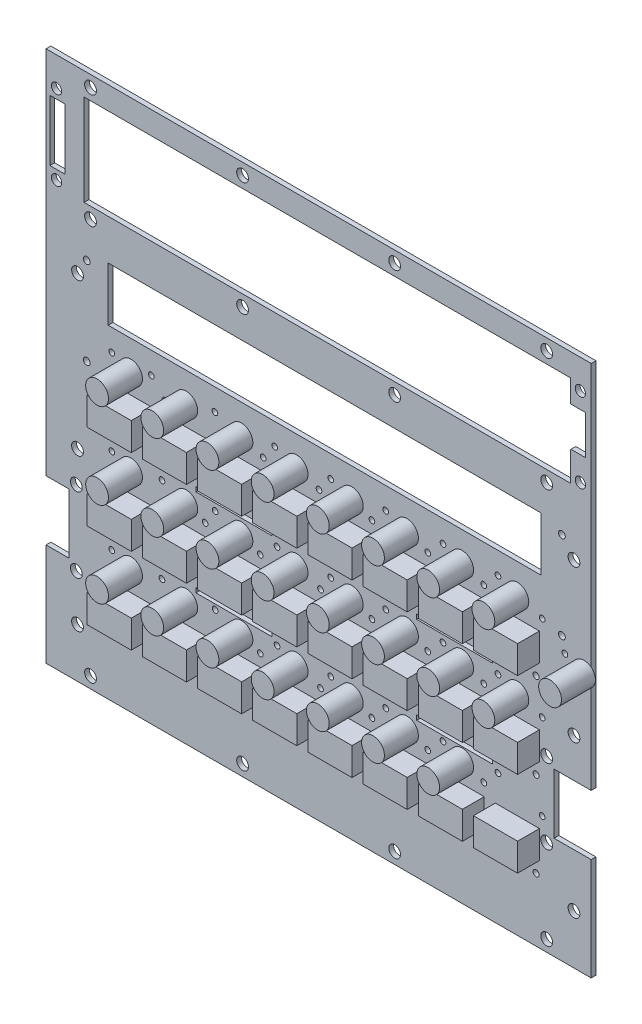
from build123d import *

# Parameters (mm, degrees)
SKETCH1_W                       = 144.56156
SKETCH1_H                       = 18.00098
SKETCH1_W_2                     = 5.08
SKETCH1_H_2                     = 20.32
SKETCH1_W_3                     = 25.4
SKETCH1_H_3                     = 1.5875
BOARD_DEPTH                     = 1.592072
SKETCH2_R                       = 3.81
LED_KINGBRIGHT_3P_2P54_1_DEPTH  = 11.3538
SKETCH4_R                       = 3.81
LED_KINGBRIGHT_3P_2P54_3_DEPTH  = 11.3538
SKETCH5_R                       = 3.81
LED_KINGBRIGHT_3P_2P54_4_DEPTH  = 11.3538
SKETCH6_R                       = 3.81
LED_KINGBRIGHT_3P_2P54_5_DEPTH  = 11.3538
SKETCH7_R                       = 3.81
LED_KINGBRIGHT_3P_2P54_6_DEPTH  = 11.3538
SKETCH8_R                       = 3.81
LED_KINGBRIGHT_3P_2P54_7_DEPTH  = 11.3538
SKETCH9_R                       = 3.81
LED_KINGBRIGHT_3P_2P54_8_DEPTH  = 11.3538
SKETCH10_R                      = 3.81
LED_KINGBRIGHT_3P_2P54_9_DEPTH  = 11.3538
SKETCH11_R                      = 3.81
LED_KINGBRIGHT_3P_2P54_10_DEPTH = 11.3538
SKETCH12_R                      = 3.81
LED_KINGBRIGHT_3P_2P54_11_DEPTH = 11.3538
SKETCH13_R                      = 3.81
LED_KINGBRIGHT_3P_2P54_12_DEPTH = 11.3538
SKETCH14_R                      = 3.81
LED_KINGBRIGHT_3P_2P54_13_DEPTH = 11.3538
SKETCH15_R                      = 3.81
LED_KINGBRIGHT_3P_2P54_14_DEPTH = 11.3538
SKETCH16_R                      = 3.81
LED_KINGBRIGHT_3P_2P54_15_DEPTH = 11.3538
SKETCH17_R                      = 3.81
LED_KINGBRIGHT_3P_2P54_16_DEPTH = 11.3538
SKETCH18_R                      = 3.81
LED_KINGBRIGHT_3P_2P54_17_DEPTH = 11.3538
SKETCH19_R                      = 3.81
LED_KINGBRIGHT_3P_2P54_18_DEPTH = 11.3538
SKETCH20_R                      = 3.81
LED_KINGBRIGHT_3P_2P54_19_DEPTH = 11.3538
SKETCH21_R                      = 3.81
LED_KINGBRIGHT_3P_2P54_20_DEPTH = 11.3538
SKETCH22_R                      = 3.81
LED_KINGBRIGHT_3P_2P54_21_DEPTH = 11.3538
SKETCH23_R                      = 3.81
LED_KINGBRIGHT_3P_2P54_22_DEPTH = 11.3538
SKETCH24_R                      = 3.81
LED_KINGBRIGHT_3P_2P54_23_DEPTH = 11.3538
SKETCH25_R                      = 3.81
LED_KINGBRIGHT_3P_2P54_24_DEPTH = 11.3538
SKETCH26_R                      = 3.81
LED_KINGBRIGHT_3P_2P54_25_DEPTH = 11.3538
SKETCH27_W                      = 14.732
SKETCH27_H                      = 9.271
SWITCH_MCDTS2_1_DEPTH           = 7.3000108
SKETCH28_W                      = 14.732
SKETCH28_H                      = 9.271
SWITCH_MCDTS2_2_DEPTH           = 7.3000108
SKETCH29_W                      = 14.732
SKETCH29_H                      = 9.271
SWITCH_MCDTS2_3_DEPTH           = 7.3000108
SKETCH30_W                      = 14.732
SKETCH30_H                      = 9.271
SWITCH_MCDTS2_4_DEPTH           = 7.3000108
SKETCH31_W                      = 14.732
SKETCH31_H                      = 9.271
SWITCH_MCDTS2_5_DEPTH           = 7.3000108
SKETCH32_W                      = 14.732
SKETCH32_H                      = 9.271
SWITCH_MCDTS2_6_DEPTH           = 7.3000108
SKETCH33_W                      = 14.732
SKETCH33_H                      = 9.271
SWITCH_MCDTS2_7_DEPTH           = 7.3000108
SKETCH34_W                      = 14.732
SKETCH34_H                      = 9.271
SWITCH_MCDTS2_8_DEPTH           = 7.3000108
SKETCH35_W                      = 14.732
SKETCH35_H                      = 9.271
SWITCH_MCDTS2_9_DEPTH           = 7.3000108
SKETCH36_W                      = 14.732
SKETCH36_H                      = 9.271
SWITCH_MCDTS2_10_DEPTH          = 7.3000108
SKETCH37_W                      = 14.732
SKETCH37_H                      = 9.271
SWITCH_MCDTS2_11_DEPTH          = 7.3000108
SKETCH38_W                      = 14.732
SKETCH38_H                      = 9.271
SWITCH_MCDTS2_12_DEPTH          = 7.3000108
SKETCH39_W                      = 14.732
SKETCH39_H                      = 9.271
SWITCH_MCDTS2_13_DEPTH          = 7.3000108
SKETCH40_W                      = 14.732
SKETCH40_H                      = 9.271
SWITCH_MCDTS2_14_DEPTH          = 7.3000108
SKETCH41_W                      = 14.732
SKETCH41_H                      = 9.271
SWITCH_MCDTS2_15_DEPTH          = 7.3000108
SKETCH42_W                      = 14.732
SKETCH42_H                      = 9.271
SWITCH_MCDTS2_16_DEPTH          = 7.3000108
SKETCH43_W                      = 14.732
SKETCH43_H                      = 9.271
SWITCH_MCDTS2_17_DEPTH          = 7.3000108
SKETCH44_W                      = 14.732
SKETCH44_H                      = 9.271
SWITCH_MCDTS2_18_DEPTH          = 7.3000108
SKETCH45_W                      = 14.732
SKETCH45_H                      = 9.271
SWITCH_MCDTS2_19_DEPTH          = 7.3000108
SKETCH46_W                      = 14.732
SKETCH46_H                      = 9.271
SWITCH_MCDTS2_20_DEPTH          = 7.3000108
SKETCH47_W                      = 14.732
SKETCH47_H                      = 9.271
SWITCH_MCDTS2_21_DEPTH          = 7.3000108
SKETCH48_W                      = 14.732
SKETCH48_H                      = 9.271
SWITCH_MCDTS2_22_DEPTH          = 7.3000108
SKETCH49_W                      = 14.732
SKETCH49_H                      = 9.271
SWITCH_MCDTS2_23_DEPTH          = 7.3000108
SKETCH50_W                      = 14.732
SKETCH50_H                      = 9.271
SWITCH_MCDTS2_24_DEPTH          = 7.3000108
SKETCH59_R                      = 1.016
SKETCH59_R_2                    = 0.9652
SKETCH59_R_3                    = 0.9525
SKETCH59_R_4                    = 1.9685
SKETCH59_R_5                    = 1.1303
SKETCH59_R_6                    = 1.7145
CUT_EXTRUDE1_DEPTH              = 10


with BuildPart() as part:
    # Sketch1 → BOARD (new body)
    with BuildSketch(Plane.XY):
        Polygon((0, 0), (182.118, 0), (182.118, 34.24682), (169.7355, 34.24682), (169.7355, 54.24678), (182.118, 54.24678), (182.118, 177.8), (0, 177.8), (0, 54.24678), (7.62, 54.24678), (7.62, 34.24682), (0, 34.24682), align=None)
        with Locations((93.01988, 117.17909)):
            Rectangle(SKETCH1_W, SKETCH1_H, mode=Mode.SUBTRACT)
        with Locations((3.81, 154.813)):
            Rectangle(SKETCH1_W_2, SKETCH1_H_2, mode=Mode.SUBTRACT)
        Polygon((12.7, 139.7), (12.7, 170.18), (175.26, 170.18), (175.26, 162.6616), (180.086, 162.6616), (180.2892, 162.4584), (180.2892, 149.606), (175.3616, 149.606), (175.26, 149.5044), (175.26, 139.7), align=None, mode=Mode.SUBTRACT)
        with Locations((62.7634, 46.20895)):
            Rectangle(SKETCH1_W_3, SKETCH1_H_3, mode=Mode.SUBTRACT)
        with Locations((136.5134176, 46.20895)):
            Rectangle(SKETCH1_W_3, SKETCH1_H_3, mode=Mode.SUBTRACT)
        with Locations((136.5134176, 75.41895)):
            Rectangle(SKETCH1_W_3, SKETCH1_H_3, mode=Mode.SUBTRACT)
        with Locations((62.7634, 75.41895)):
            Rectangle(SKETCH1_W_3, SKETCH1_H_3, mode=Mode.SUBTRACT)
    extrude(amount=BOARD_DEPTH)

    # Sketch59 → Cut-Extrude1 (cut)
    with BuildSketch(Plane.XY.offset(1.592072)):
        with Locations((163.703, 21.1074)):
            Circle(SKETCH59_R)
        with Locations((163.703, 49.6824)):
            Circle(SKETCH59_R)
        with Locations((145.2626, 21.8186)):
            Circle(SKETCH59_R_2)
        with Locations((126.8476, 21.6154)):
            Circle(SKETCH59_R_2)
        with Locations((108.4072, 21.7424)):
            Circle(SKETCH59_R_2)
        with Locations((89.9668, 21.844)):
            Circle(SKETCH59_R_2)
        with Locations((71.5264, 20.7772)):
            Circle(SKETCH59_R_2)
        with Locations((53.086, 21.1582)):
            Circle(SKETCH59_R_2)
        with Locations((34.6472002, 21.1328)):
            Circle(SKETCH59_R)
        with Locations((145.2626, 49.5554)):
            Circle(SKETCH59_R)
        with Locations((126.8222, 49.3522)):
            Circle(SKETCH59_R)
        with Locations((108.3818, 49.1236)):
            Circle(SKETCH59_R)
        with Locations((89.9414, 49.6824)):
            Circle(SKETCH59_R)
        with Locations((71.501, 49.1998)):
            Circle(SKETCH59_R)
        with Locations((53.0606, 49.1998)):
            Circle(SKETCH59_R)
        with Locations((34.6202, 49.276)):
            Circle(SKETCH59_R)
        with Locations((163.703, 78.2574)):
            Circle(SKETCH59_R)
        with Locations((145.2626, 77.7748)):
            Circle(SKETCH59_R)
        with Locations((126.746, 78.3336)):
            Circle(SKETCH59_R)
        with Locations((108.3818, 78.74)):
            Circle(SKETCH59_R)
        with Locations((89.9414, 78.3336)):
            Circle(SKETCH59_R)
        with Locations((71.501, 78.2574)):
            Circle(SKETCH59_R)
        with Locations((53.0606, 78.4098)):
            Circle(SKETCH59_R)
        with Locations((34.6202, 78.0542)):
            Circle(SKETCH59_R)
        with Locations((91.694, 38.6588)):
            Circle(SKETCH59_R_3)
        with Locations((77.1652, 43.7388)):
            Circle(SKETCH59_R_3)
        with Locations((71.5772, 38.6588)):
            Circle(SKETCH59_R_3)
        with Locations((56.4896, 43.7388)):
            Circle(SKETCH59_R_3)
        with Locations((38.735, 43.7388)):
            Circle(SKETCH59_R_3)
        with Locations((21.8948, 38.6588)):
            Circle(SKETCH59_R_3)
        with Locations((21.971, 43.7388)):
            Circle(SKETCH59_R_3)
        with Locations((77.1652, 72.3138)):
            Circle(SKETCH59_R_3)
        with Locations((91.694, 67.2338)):
            Circle(SKETCH59_R_3)
        with Locations((71.5772, 67.2338)):
            Circle(SKETCH59_R_3)
        with Locations((56.4896, 72.3138)):
            Circle(SKETCH59_R_3)
        with Locations((53.1368, 67.2338)):
            Circle(SKETCH59_R_3)
        with Locations((38.735, 72.3138)):
            Circle(SKETCH59_R_3)
        with Locations((21.8948, 67.2338)):
            Circle(SKETCH59_R_3)
        with Locations((21.971, 72.3138)):
            Circle(SKETCH59_R_3)
        with Locations((165.735, 95.8088)):
            Circle(SKETCH59_R_3)
        with Locations((150.9776, 100.8888)):
            Circle(SKETCH59_R_3)
        with Locations((146.2278, 95.8088)):
            Circle(SKETCH59_R_3)
        with Locations((132.6134, 100.8888)):
            Circle(SKETCH59_R_3)
        with Locations((113.4872, 100.8888)):
            Circle(SKETCH59_R_3)
        with Locations((127.508, 95.8088)):
            Circle(SKETCH59_R_3)
        with Locations((108.8644, 95.8088)):
            Circle(SKETCH59_R_3)
        with Locations((95.0976, 100.8888)):
            Circle(SKETCH59_R_3)
        with Locations((91.186, 95.8088)):
            Circle(SKETCH59_R_3)
        with Locations((76.3778, 100.8888)):
            Circle(SKETCH59_R_3)
        with Locations((72.5424, 95.8088)):
            Circle(SKETCH59_R_3)
        with Locations((56.4134, 100.8888)):
            Circle(SKETCH59_R_3)
        with Locations((39.7256, 95.8088)):
            Circle(SKETCH59_R_3)
        with Locations((35.179, 100.8888)):
            Circle(SKETCH59_R_3)
        with Locations((24.2062, 95.8088)):
            Circle(SKETCH59_R_3)
        with Locations((21.971, 100.8888)):
            Circle(SKETCH59_R_3)
        with Locations((132.6134, 72.3138)):
            Circle(SKETCH59_R_3)
        with Locations((146.2278, 67.2338)):
            Circle(SKETCH59_R_3)
        with Locations((113.4872, 72.3138)):
            Circle(SKETCH59_R_3)
        with Locations((127.508, 67.2338)):
            Circle(SKETCH59_R_3)
        with Locations((95.0976, 72.3138)):
            Circle(SKETCH59_R_3)
        with Locations((108.8644, 67.2338)):
            Circle(SKETCH59_R_3)
        with Locations((173.3296, 89.4588)):
            Circle(SKETCH59_R_3)
        with Locations((150.9776, 43.7388)):
            Circle(SKETCH59_R_3)
        with Locations((132.6134, 43.7388)):
            Circle(SKETCH59_R_3)
        with Locations((113.4872, 43.7388)):
            Circle(SKETCH59_R_3)
        with Locations((95.0976, 43.7388)):
            Circle(SKETCH59_R_3)
        with Locations((108.8644, 38.6588)):
            Circle(SKETCH59_R_3)
        with Locations((150.9776, 72.3138)):
            Circle(SKETCH59_R_3)
        with Locations((165.735, 67.2338)):
            Circle(SKETCH59_R_3)
        with Locations((173.355, 84.3534)):
            Circle(SKETCH59_R_3)
        with Locations((176.37252, 118.11)):
            Circle(SKETCH59_R_4)
        with Locations((176.37252, 67.31)):
            Circle(SKETCH59_R_4)
        with Locations((176.37252, 16.51)):
            Circle(SKETCH59_R_4)
        with Locations((167.259, 135.89)):
            Circle(SKETCH59_R_4)
        with Locations((116.459, 135.89)):
            Circle(SKETCH59_R_4)
        with Locations((65.659, 135.89)):
            Circle(SKETCH59_R_4)
        with Locations((14.859, 135.89)):
            Circle(SKETCH59_R_4)
        with Locations((10.51052, 118.11)):
            Circle(SKETCH59_R_4)
        with Locations((10.51052, 67.31)):
            Circle(SKETCH59_R_4)
        with Locations((10.51052, 16.51)):
            Circle(SKETCH59_R_4)
        with Locations((165.735, 38.6588)):
            Circle(SKETCH59_R_3)
        with Locations((146.2278, 38.6588)):
            Circle(SKETCH59_R_3)
        with Locations((127.508, 38.6588)):
            Circle(SKETCH59_R_3)
        with Locations((14.859, 173.99)):
            Circle(SKETCH59_R_4)
        with Locations((65.659, 173.99)):
            Circle(SKETCH59_R_4)
        with Locations((116.459, 173.99)):
            Circle(SKETCH59_R_4)
        with Locations((167.259, 173.99)):
            Circle(SKETCH59_R_4)
        with Locations((167.259, 3.81)):
            Circle(SKETCH59_R_4)
        with Locations((116.459, 3.81)):
            Circle(SKETCH59_R_4)
        with Locations((65.659, 3.81)):
            Circle(SKETCH59_R_4)
        with Locations((14.859, 3.81)):
            Circle(SKETCH59_R_4)
        with Locations((167.2336, 56.7436)):
            Circle(SKETCH59_R_4)
        with Locations((167.2336, 31.75)):
            Circle(SKETCH59_R_4)
        with Locations((10.11682, 56.7436)):
            Circle(SKETCH59_R_4)
        with Locations((10.11682, 31.75)):
            Circle(SKETCH59_R_4)
        with Locations((172.34154, 123.37542)):
            Circle(SKETCH59_R_5)
        with Locations((172.34154, 94.16542)):
            Circle(SKETCH59_R_5)
        with Locations((13.59154, 94.16542)):
            Circle(SKETCH59_R_5)
        with Locations((13.59154, 123.37542)):
            Circle(SKETCH59_R_5)
        with Locations((178.51374, 141.56182)):
            Circle(SKETCH59_R_6)
        with Locations((178.51374, 168.06164)):
            Circle(SKETCH59_R_6)
        with Locations((3.50012, 168.06164)):
            Circle(SKETCH59_R_6)
        with Locations((3.50012, 141.56182)):
            Circle(SKETCH59_R_6)
    extrude(amount=-CUT_EXTRUDE1_DEPTH, mode=Mode.SUBTRACT)


with BuildPart() as body_2:
    # Sketch2 → LED-KINGBRIGHT_3P_2P54-1 (new body)
    with BuildSketch(Plane.XY.offset(1.592072)):
        with Locations((179.73548, 86.9188)):
            Circle(SKETCH2_R)
    extrude(amount=LED_KINGBRIGHT_3P_2P54_1_DEPTH)


with BuildPart() as body_3:
    # Sketch4 → LED-KINGBRIGHT_3P_2P54-3 (new body)
    with BuildSketch(Plane.XY.offset(1.592072)):
        with Locations((139.022201, 41.1988)):
            Circle(SKETCH4_R)
    extrude(amount=LED_KINGBRIGHT_3P_2P54_3_DEPTH)


with BuildPart() as body_4:
    # Sketch5 → LED-KINGBRIGHT_3P_2P54-4 (new body)
    with BuildSketch(Plane.XY.offset(1.592072)):
        with Locations((120.5846966, 41.1988)):
            Circle(SKETCH5_R)
    extrude(amount=LED_KINGBRIGHT_3P_2P54_4_DEPTH)


with BuildPart() as body_5:
    # Sketch6 → LED-KINGBRIGHT_3P_2P54-5 (new body)
    with BuildSketch(Plane.XY.offset(1.592072)):
        with Locations((102.1472176, 41.1988)):
            Circle(SKETCH6_R)
    extrude(amount=LED_KINGBRIGHT_3P_2P54_5_DEPTH)


with BuildPart() as body_6:
    # Sketch7 → LED-KINGBRIGHT_3P_2P54-6 (new body)
    with BuildSketch(Plane.XY.offset(1.592072)):
        with Locations((157.4597308, 69.7738)):
            Circle(SKETCH7_R)
    extrude(amount=LED_KINGBRIGHT_3P_2P54_6_DEPTH)


with BuildPart() as body_7:
    # Sketch8 → LED-KINGBRIGHT_3P_2P54-7 (new body)
    with BuildSketch(Plane.XY.offset(1.592072)):
        with Locations((139.0222264, 69.7738)):
            Circle(SKETCH8_R)
    extrude(amount=LED_KINGBRIGHT_3P_2P54_7_DEPTH)


with BuildPart() as body_8:
    # Sketch9 → LED-KINGBRIGHT_3P_2P54-8 (new body)
    with BuildSketch(Plane.XY.offset(1.592072)):
        with Locations((120.584722, 69.7738)):
            Circle(SKETCH9_R)
    extrude(amount=LED_KINGBRIGHT_3P_2P54_8_DEPTH)


with BuildPart() as body_9:
    # Sketch10 → LED-KINGBRIGHT_3P_2P54-9 (new body)
    with BuildSketch(Plane.XY.offset(1.592072)):
        with Locations((102.1472176, 69.7738)):
            Circle(SKETCH10_R)
    extrude(amount=LED_KINGBRIGHT_3P_2P54_9_DEPTH)


with BuildPart() as body_10:
    # Sketch11 → LED-KINGBRIGHT_3P_2P54-10 (new body)
    with BuildSketch(Plane.XY.offset(1.592072)):
        with Locations((83.7097132, 41.1988)):
            Circle(SKETCH11_R)
    extrude(amount=LED_KINGBRIGHT_3P_2P54_10_DEPTH)


with BuildPart() as body_11:
    # Sketch12 → LED-KINGBRIGHT_3P_2P54-11 (new body)
    with BuildSketch(Plane.XY.offset(1.592072)):
        with Locations((65.2722088, 41.1988)):
            Circle(SKETCH12_R)
    extrude(amount=LED_KINGBRIGHT_3P_2P54_11_DEPTH)


with BuildPart() as body_12:
    # Sketch13 → LED-KINGBRIGHT_3P_2P54-12 (new body)
    with BuildSketch(Plane.XY.offset(1.592072)):
        with Locations((46.8347044, 41.1988)):
            Circle(SKETCH13_R)
    extrude(amount=LED_KINGBRIGHT_3P_2P54_12_DEPTH)


with BuildPart() as body_13:
    # Sketch14 → LED-KINGBRIGHT_3P_2P54-13 (new body)
    with BuildSketch(Plane.XY.offset(1.592072)):
        with Locations((28.3972, 41.1988)):
            Circle(SKETCH14_R)
    extrude(amount=LED_KINGBRIGHT_3P_2P54_13_DEPTH)


with BuildPart() as body_14:
    # Sketch15 → LED-KINGBRIGHT_3P_2P54-14 (new body)
    with BuildSketch(Plane.XY.offset(1.592072)):
        with Locations((83.7097132, 69.7738)):
            Circle(SKETCH15_R)
    extrude(amount=LED_KINGBRIGHT_3P_2P54_14_DEPTH)


with BuildPart() as body_15:
    # Sketch16 → LED-KINGBRIGHT_3P_2P54-15 (new body)
    with BuildSketch(Plane.XY.offset(1.592072)):
        with Locations((65.2722088, 69.7738)):
            Circle(SKETCH16_R)
    extrude(amount=LED_KINGBRIGHT_3P_2P54_15_DEPTH)


with BuildPart() as body_16:
    # Sketch17 → LED-KINGBRIGHT_3P_2P54-16 (new body)
    with BuildSketch(Plane.XY.offset(1.592072)):
        with Locations((46.8347044, 69.7738)):
            Circle(SKETCH17_R)
    extrude(amount=LED_KINGBRIGHT_3P_2P54_16_DEPTH)


with BuildPart() as body_17:
    # Sketch18 → LED-KINGBRIGHT_3P_2P54-17 (new body)
    with BuildSketch(Plane.XY.offset(1.592072)):
        with Locations((28.3972, 69.7738)):
            Circle(SKETCH18_R)
    extrude(amount=LED_KINGBRIGHT_3P_2P54_17_DEPTH)


with BuildPart() as body_18:
    # Sketch19 → LED-KINGBRIGHT_3P_2P54-18 (new body)
    with BuildSketch(Plane.XY.offset(1.592072)):
        with Locations((157.4597308, 98.3488)):
            Circle(SKETCH19_R)
    extrude(amount=LED_KINGBRIGHT_3P_2P54_18_DEPTH)


with BuildPart() as body_19:
    # Sketch20 → LED-KINGBRIGHT_3P_2P54-19 (new body)
    with BuildSketch(Plane.XY.offset(1.592072)):
        with Locations((139.0222264, 98.3488)):
            Circle(SKETCH20_R)
    extrude(amount=LED_KINGBRIGHT_3P_2P54_19_DEPTH)


with BuildPart() as body_20:
    # Sketch21 → LED-KINGBRIGHT_3P_2P54-20 (new body)
    with BuildSketch(Plane.XY.offset(1.592072)):
        with Locations((120.584722, 98.3488)):
            Circle(SKETCH21_R)
    extrude(amount=LED_KINGBRIGHT_3P_2P54_20_DEPTH)


with BuildPart() as body_21:
    # Sketch22 → LED-KINGBRIGHT_3P_2P54-21 (new body)
    with BuildSketch(Plane.XY.offset(1.592072)):
        with Locations((102.1472176, 98.3488)):
            Circle(SKETCH22_R)
    extrude(amount=LED_KINGBRIGHT_3P_2P54_21_DEPTH)


with BuildPart() as body_22:
    # Sketch23 → LED-KINGBRIGHT_3P_2P54-22 (new body)
    with BuildSketch(Plane.XY.offset(1.592072)):
        with Locations((83.7097132, 98.3488)):
            Circle(SKETCH23_R)
    extrude(amount=LED_KINGBRIGHT_3P_2P54_22_DEPTH)


with BuildPart() as body_23:
    # Sketch24 → LED-KINGBRIGHT_3P_2P54-23 (new body)
    with BuildSketch(Plane.XY.offset(1.592072)):
        with Locations((65.2722088, 98.3488)):
            Circle(SKETCH24_R)
    extrude(amount=LED_KINGBRIGHT_3P_2P54_23_DEPTH)


with BuildPart() as body_24:
    # Sketch25 → LED-KINGBRIGHT_3P_2P54-24 (new body)
    with BuildSketch(Plane.XY.offset(1.592072)):
        with Locations((46.8347044, 98.3488)):
            Circle(SKETCH25_R)
    extrude(amount=LED_KINGBRIGHT_3P_2P54_24_DEPTH)


with BuildPart() as body_25:
    # Sketch26 → LED-KINGBRIGHT_3P_2P54-25 (new body)
    with BuildSketch(Plane.XY.offset(1.592072)):
        with Locations((28.3972, 98.3488)):
            Circle(SKETCH26_R)
    extrude(amount=LED_KINGBRIGHT_3P_2P54_25_DEPTH)


with BuildPart() as body_26:
    # Sketch27 → SWITCH-MCDTS2-1 (new body)
    with BuildSketch(Plane.XY.offset(1.592072)):
        with Locations((157.4597308, 29.9593)):
            Rectangle(SKETCH27_W, SKETCH27_H)
    extrude(amount=SWITCH_MCDTS2_1_DEPTH)


with BuildPart() as body_27:
    # Sketch28 → SWITCH-MCDTS2-2 (new body)
    with BuildSketch(Plane.XY.offset(1.592072)):
        with Locations((157.4597308, 58.5343)):
            Rectangle(SKETCH28_W, SKETCH28_H)
    extrude(amount=SWITCH_MCDTS2_2_DEPTH)


with BuildPart() as body_28:
    # Sketch29 → SWITCH-MCDTS2-3 (new body)
    with BuildSketch(Plane.XY.offset(1.592072)):
        with Locations((139.0222264, 29.9593)):
            Rectangle(SKETCH29_W, SKETCH29_H)
    extrude(amount=SWITCH_MCDTS2_3_DEPTH)


with BuildPart() as body_29:
    # Sketch30 → SWITCH-MCDTS2-4 (new body)
    with BuildSketch(Plane.XY.offset(1.592072)):
        with Locations((120.584722, 29.9593)):
            Rectangle(SKETCH30_W, SKETCH30_H)
    extrude(amount=SWITCH_MCDTS2_4_DEPTH)


with BuildPart() as body_30:
    # Sketch31 → SWITCH-MCDTS2-5 (new body)
    with BuildSketch(Plane.XY.offset(1.592072)):
        with Locations((102.1472176, 29.9593)):
            Rectangle(SKETCH31_W, SKETCH31_H)
    extrude(amount=SWITCH_MCDTS2_5_DEPTH)


with BuildPart() as body_31:
    # Sketch32 → SWITCH-MCDTS2-6 (new body)
    with BuildSketch(Plane.XY.offset(1.592072)):
        with Locations((83.7097132, 29.9593)):
            Rectangle(SKETCH32_W, SKETCH32_H)
    extrude(amount=SWITCH_MCDTS2_6_DEPTH)


with BuildPart() as body_32:
    # Sketch33 → SWITCH-MCDTS2-7 (new body)
    with BuildSketch(Plane.XY.offset(1.592072)):
        with Locations((65.2722088, 29.9593)):
            Rectangle(SKETCH33_W, SKETCH33_H)
    extrude(amount=SWITCH_MCDTS2_7_DEPTH)


with BuildPart() as body_33:
    # Sketch34 → SWITCH-MCDTS2-8 (new body)
    with BuildSketch(Plane.XY.offset(1.592072)):
        with Locations((46.8347044, 29.9593)):
            Rectangle(SKETCH34_W, SKETCH34_H)
    extrude(amount=SWITCH_MCDTS2_8_DEPTH)


with BuildPart() as body_34:
    # Sketch35 → SWITCH-MCDTS2-9 (new body)
    with BuildSketch(Plane.XY.offset(1.592072)):
        with Locations((28.3972, 29.9593)):
            Rectangle(SKETCH35_W, SKETCH35_H)
    extrude(amount=SWITCH_MCDTS2_9_DEPTH)


with BuildPart() as body_35:
    # Sketch36 → SWITCH-MCDTS2-10 (new body)
    with BuildSketch(Plane.XY.offset(1.592072)):
        with Locations((139.0222264, 58.5343)):
            Rectangle(SKETCH36_W, SKETCH36_H)
    extrude(amount=SWITCH_MCDTS2_10_DEPTH)


with BuildPart() as body_36:
    # Sketch37 → SWITCH-MCDTS2-11 (new body)
    with BuildSketch(Plane.XY.offset(1.592072)):
        with Locations((120.584722, 58.5343)):
            Rectangle(SKETCH37_W, SKETCH37_H)
    extrude(amount=SWITCH_MCDTS2_11_DEPTH)


with BuildPart() as body_37:
    # Sketch38 → SWITCH-MCDTS2-12 (new body)
    with BuildSketch(Plane.XY.offset(1.592072)):
        with Locations((102.1472176, 58.5343)):
            Rectangle(SKETCH38_W, SKETCH38_H)
    extrude(amount=SWITCH_MCDTS2_12_DEPTH)


with BuildPart() as body_38:
    # Sketch39 → SWITCH-MCDTS2-13 (new body)
    with BuildSketch(Plane.XY.offset(1.592072)):
        with Locations((83.7097132, 58.5343)):
            Rectangle(SKETCH39_W, SKETCH39_H)
    extrude(amount=SWITCH_MCDTS2_13_DEPTH)


with BuildPart() as body_39:
    # Sketch40 → SWITCH-MCDTS2-14 (new body)
    with BuildSketch(Plane.XY.offset(1.592072)):
        with Locations((65.2722088, 58.5343)):
            Rectangle(SKETCH40_W, SKETCH40_H)
    extrude(amount=SWITCH_MCDTS2_14_DEPTH)


with BuildPart() as body_40:
    # Sketch41 → SWITCH-MCDTS2-15 (new body)
    with BuildSketch(Plane.XY.offset(1.592072)):
        with Locations((46.8347044, 58.5343)):
            Rectangle(SKETCH41_W, SKETCH41_H)
    extrude(amount=SWITCH_MCDTS2_15_DEPTH)


with BuildPart() as body_41:
    # Sketch42 → SWITCH-MCDTS2-16 (new body)
    with BuildSketch(Plane.XY.offset(1.592072)):
        with Locations((28.3972, 58.5343)):
            Rectangle(SKETCH42_W, SKETCH42_H)
    extrude(amount=SWITCH_MCDTS2_16_DEPTH)


with BuildPart() as body_42:
    # Sketch43 → SWITCH-MCDTS2-17 (new body)
    with BuildSketch(Plane.XY.offset(1.592072)):
        with Locations((157.4597308, 87.1093)):
            Rectangle(SKETCH43_W, SKETCH43_H)
    extrude(amount=SWITCH_MCDTS2_17_DEPTH)


with BuildPart() as body_43:
    # Sketch44 → SWITCH-MCDTS2-18 (new body)
    with BuildSketch(Plane.XY.offset(1.592072)):
        with Locations((139.0222264, 87.1093)):
            Rectangle(SKETCH44_W, SKETCH44_H)
    extrude(amount=SWITCH_MCDTS2_18_DEPTH)


with BuildPart() as body_44:
    # Sketch45 → SWITCH-MCDTS2-19 (new body)
    with BuildSketch(Plane.XY.offset(1.592072)):
        with Locations((120.584722, 87.1093)):
            Rectangle(SKETCH45_W, SKETCH45_H)
    extrude(amount=SWITCH_MCDTS2_19_DEPTH)


with BuildPart() as body_45:
    # Sketch46 → SWITCH-MCDTS2-20 (new body)
    with BuildSketch(Plane.XY.offset(1.592072)):
        with Locations((102.1472176, 87.1093)):
            Rectangle(SKETCH46_W, SKETCH46_H)
    extrude(amount=SWITCH_MCDTS2_20_DEPTH)


with BuildPart() as body_46:
    # Sketch47 → SWITCH-MCDTS2-21 (new body)
    with BuildSketch(Plane.XY.offset(1.592072)):
        with Locations((83.7097132, 87.1093)):
            Rectangle(SKETCH47_W, SKETCH47_H)
    extrude(amount=SWITCH_MCDTS2_21_DEPTH)


with BuildPart() as body_47:
    # Sketch48 → SWITCH-MCDTS2-22 (new body)
    with BuildSketch(Plane.XY.offset(1.592072)):
        with Locations((65.2722088, 87.1093)):
            Rectangle(SKETCH48_W, SKETCH48_H)
    extrude(amount=SWITCH_MCDTS2_22_DEPTH)


with BuildPart() as body_48:
    # Sketch49 → SWITCH-MCDTS2-23 (new body)
    with BuildSketch(Plane.XY.offset(1.592072)):
        with Locations((46.8347044, 87.1093)):
            Rectangle(SKETCH49_W, SKETCH49_H)
    extrude(amount=SWITCH_MCDTS2_23_DEPTH)


with BuildPart() as body_49:
    # Sketch50 → SWITCH-MCDTS2-24 (new body)
    with BuildSketch(Plane.XY.offset(1.592072)):
        with Locations((28.3972, 87.1093)):
            Rectangle(SKETCH50_W, SKETCH50_H)
    extrude(amount=SWITCH_MCDTS2_24_DEPTH)


solid = Compound([part.part, body_2.part, body_3.part, body_4.part, body_5.part, body_6.part, body_7.part, body_8.part, body_9.part, body_10.part, body_11.part, body_12.part, body_13.part, body_14.part, body_15.part, body_16.part, body_17.part, body_18.part, body_19.part, body_20.part, body_21.part, body_22.part, body_23.part, body_24.part, body_25.part, body_26.part, body_27.part, body_28.part, body_29.part, body_30.part, body_31.part, body_32.part, body_33.part, body_34.part, body_35.part, body_36.part, body_37.part, body_38.part, body_39.part, body_40.part, body_41.part, body_42.part, body_43.part, body_44.part, body_45.part, body_46.part, body_47.part, body_48.part, body_49.part])
